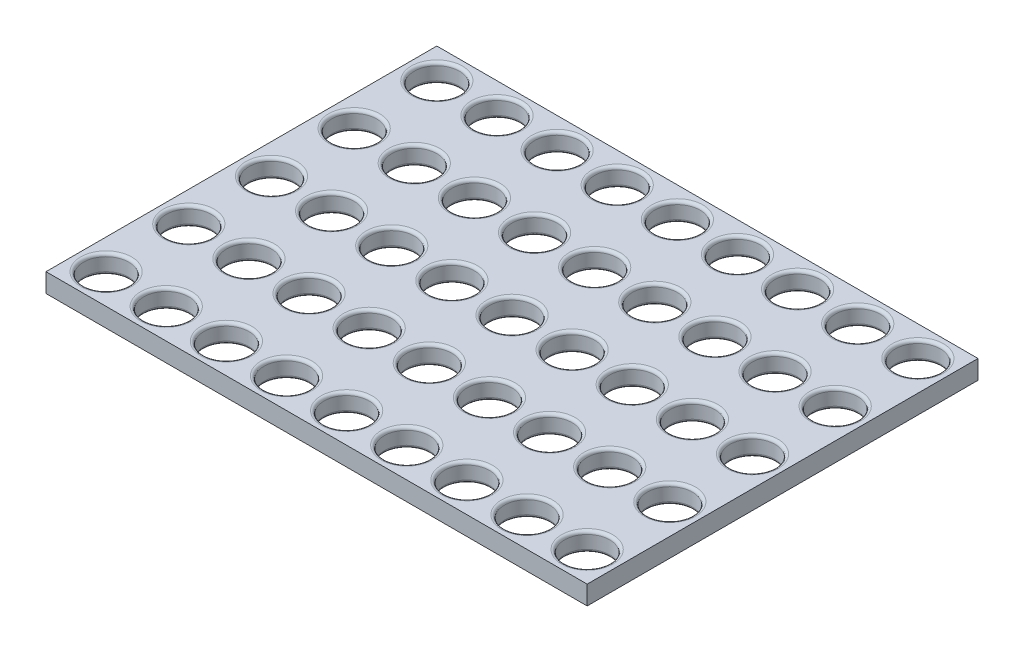
from build123d import *

# Parameters (mm, degrees)
SKETCH1_W           = 45.72
SKETCH1_H           = 33.02
BOSS_EXTRUDE1_DEPTH = 1.6
SKETCH2_R           = 1.905
CUT_EXTRUDE2_DEPTH  = 1.6
FILLET3_R           = 0.254


with BuildPart() as part:
    # Sketch1 → Boss-Extrude1 (new body)
    with BuildSketch(Plane(origin=(0, 0, 0), x_dir=(1, 0, 0), z_dir=(0, 1, 0))):
        with Locations((4.460487805, -3.546707317)):
            Rectangle(SKETCH1_W, SKETCH1_H)
    extrude(amount=BOSS_EXTRUDE1_DEPTH)

    # Sketch2 → Cut-Extrude2 (cut)
    with BuildSketch(Plane(origin=(0, 1.6, 0), x_dir=(1, 0, 0), z_dir=(0, 1, 0))):
        with Locations(Location((-15.859512195, 10.423292683, 0), (0, 0, 270))):
            Circle(SKETCH2_R)
        with Locations(Location((-10.779512195, 10.423292683, 0), (0, 0, 270))):
            Circle(SKETCH2_R)
        with Locations(Location((-5.699512195, 10.423292683, 0), (0, 0, 270))):
            Circle(SKETCH2_R)
        with Locations(Location((-0.619512195, 10.423292683, 0), (0, 0, 270))):
            Circle(SKETCH2_R)
        with Locations(Location((4.460487805, 10.423292683, 0), (0, 0, 270))):
            Circle(SKETCH2_R)
        with Locations(Location((9.540487805, 10.423292683, 0), (0, 0, 270))):
            Circle(SKETCH2_R)
        with Locations(Location((14.620487805, 10.423292683, 0), (0, 0, 270))):
            Circle(SKETCH2_R)
        with Locations(Location((19.700487805, 10.423292683, 0), (0, 0, 270))):
            Circle(SKETCH2_R)
        with Locations(Location((24.780487805, 10.423292683, 0), (0, 0, 270))):
            Circle(SKETCH2_R)
        with Locations(Location((-10.779512195, 3.438292683, 0), (0, 0, 270))):
            Circle(SKETCH2_R)
        with Locations(Location((-5.699512195, 3.438292683, 0), (0, 0, 270))):
            Circle(SKETCH2_R)
        with Locations(Location((-0.619512195, 3.438292683, 0), (0, 0, 270))):
            Circle(SKETCH2_R)
        with Locations(Location((4.460487805, 3.438292683, 0), (0, 0, 270))):
            Circle(SKETCH2_R)
        with Locations(Location((9.540487805, 3.438292683, 0), (0, 0, 270))):
            Circle(SKETCH2_R)
        with Locations(Location((14.620487805, 3.438292683, 0), (0, 0, 270))):
            Circle(SKETCH2_R)
        with Locations(Location((19.700487805, 3.438292683, 0), (0, 0, 270))):
            Circle(SKETCH2_R)
        with Locations(Location((24.780487805, 3.438292683, 0), (0, 0, 270))):
            Circle(SKETCH2_R)
        with Locations(Location((-10.779512195, -3.546707317, 0), (0, 0, 270))):
            Circle(SKETCH2_R)
        with Locations(Location((-5.699512195, -3.546707317, 0), (0, 0, 270))):
            Circle(SKETCH2_R)
        with Locations(Location((-0.619512195, -3.546707317, 0), (0, 0, 270))):
            Circle(SKETCH2_R)
        with Locations(Location((4.460487805, -3.546707317, 0), (0, 0, 270))):
            Circle(SKETCH2_R)
        with Locations(Location((9.540487805, -3.546707317, 0), (0, 0, 270))):
            Circle(SKETCH2_R)
        with Locations(Location((14.620487805, -3.546707317, 0), (0, 0, 270))):
            Circle(SKETCH2_R)
        with Locations(Location((19.700487805, -3.546707317, 0), (0, 0, 270))):
            Circle(SKETCH2_R)
        with Locations(Location((24.780487805, -3.546707317, 0), (0, 0, 270))):
            Circle(SKETCH2_R)
        with Locations(Location((-10.779512195, -10.531707317, 0), (0, 0, 270))):
            Circle(SKETCH2_R)
        with Locations(Location((-5.699512195, -10.531707317, 0), (0, 0, 270))):
            Circle(SKETCH2_R)
        with Locations(Location((-0.619512195, -10.531707317, 0), (0, 0, 270))):
            Circle(SKETCH2_R)
        with Locations(Location((4.460487805, -10.531707317, 0), (0, 0, 270))):
            Circle(SKETCH2_R)
        with Locations(Location((9.540487805, -10.531707317, 0), (0, 0, 270))):
            Circle(SKETCH2_R)
        with Locations(Location((14.620487805, -10.531707317, 0), (0, 0, 270))):
            Circle(SKETCH2_R)
        with Locations(Location((19.700487805, -10.531707317, 0), (0, 0, 270))):
            Circle(SKETCH2_R)
        with Locations(Location((24.780487805, -10.531707317, 0), (0, 0, 270))):
            Circle(SKETCH2_R)
        with Locations(Location((-10.779512195, -17.516707317, 0), (0, 0, 270))):
            Circle(SKETCH2_R)
        with Locations(Location((-5.699512195, -17.516707317, 0), (0, 0, 270))):
            Circle(SKETCH2_R)
        with Locations(Location((-0.619512195, -17.516707317, 0), (0, 0, 270))):
            Circle(SKETCH2_R)
        with Locations(Location((4.460487805, -17.516707317, 0), (0, 0, 270))):
            Circle(SKETCH2_R)
        with Locations(Location((9.540487805, -17.516707317, 0), (0, 0, 270))):
            Circle(SKETCH2_R)
        with Locations(Location((14.620487805, -17.516707317, 0), (0, 0, 270))):
            Circle(SKETCH2_R)
        with Locations(Location((19.700487805, -17.516707317, 0), (0, 0, 270))):
            Circle(SKETCH2_R)
        with Locations(Location((24.780487805, -17.516707317, 0), (0, 0, 270))):
            Circle(SKETCH2_R)
        with Locations(Location((-15.859512195, 3.438292683, 0), (0, 0, 270))):
            Circle(SKETCH2_R)
        with Locations(Location((-15.859512195, -3.546707317, 0), (0, 0, 270))):
            Circle(SKETCH2_R)
        with Locations(Location((-15.859512195, -10.531707317, 0), (0, 0, 270))):
            Circle(SKETCH2_R)
        with Locations(Location((-15.859512195, -17.516707317, 0), (0, 0, 270))):
            Circle(SKETCH2_R)
    extrude(amount=-CUT_EXTRUDE2_DEPTH, mode=Mode.SUBTRACT)

    # Fillet3
    fillet3_edges = [part.edges().sort_by_distance(p)[0] for p in [
        (-0.619512195, 0, 1.641707317),
        (-0.619512195, 1.6, 1.641707317),
        (4.460487805, 0, 1.641707317),
        (4.460487805, 1.6, 1.641707317),
        (9.540487805, 0, 1.641707317),
        (9.540487805, 1.6, 1.641707317),
        (14.620487805, 0, 1.641707317),
        (14.620487805, 1.6, 1.641707317),
        (19.700487805, 0, 1.641707317),
        (19.700487805, 1.6, 1.641707317),
        (24.780487805, 0, 1.641707317),
        (24.780487805, 1.6, 1.641707317),
        (-10.779512195, 0, 8.626707317),
        (-10.779512195, 1.6, 8.626707317),
        (-5.699512195, 0, 8.626707317),
        (-5.699512195, 1.6, 8.626707317),
        (-0.619512195, 0, 8.626707317),
        (-0.619512195, 1.6, 8.626707317),
        (4.460487805, 0, 8.626707317),
        (4.460487805, 1.6, 8.626707317),
        (9.540487805, 0, 8.626707317),
        (9.540487805, 1.6, 8.626707317),
        (14.620487805, 0, 8.626707317),
        (14.620487805, 1.6, 8.626707317),
        (19.700487805, 0, 8.626707317),
        (19.700487805, 1.6, 8.626707317),
        (24.780487805, 0, 8.626707317),
        (24.780487805, 1.6, 8.626707317),
        (-10.779512195, 0, 15.611707317),
        (-10.779512195, 1.6, 15.611707317),
        (-5.699512195, 0, 15.611707317),
        (-5.699512195, 1.6, 15.611707317),
        (-0.619512195, 0, 15.611707317),
        (-0.619512195, 1.6, 15.611707317),
        (4.460487805, 0, 15.611707317),
        (4.460487805, 1.6, 15.611707317),
        (9.540487805, 0, 15.611707317),
        (9.540487805, 1.6, 15.611707317),
        (14.620487805, 0, 15.611707317),
        (14.620487805, 1.6, 15.611707317),
        (19.700487805, 0, 15.611707317),
        (19.700487805, 1.6, 15.611707317),
        (24.780487805, 0, 15.611707317),
        (24.780487805, 1.6, 15.611707317),
        (-15.859512195, 0, -5.343292683),
        (-15.859512195, 1.6, -5.343292683),
        (-15.859512195, 0, 1.641707317),
        (-15.859512195, 1.6, 1.641707317),
        (-15.859512195, 0, 8.626707317),
        (-15.859512195, 1.6, 8.626707317),
        (-15.859512195, 0, 15.611707317),
        (-15.859512195, 1.6, 15.611707317),
        (-15.859512195, 0, -12.328292683),
        (-15.859512195, 1.6, -12.328292683),
        (-10.779512195, 0, -12.328292683),
        (-10.779512195, 1.6, -12.328292683),
        (-5.699512195, 0, -12.328292683),
        (-5.699512195, 1.6, -12.328292683),
        (-0.619512195, 0, -12.328292683),
        (-0.619512195, 1.6, -12.328292683),
        (4.460487805, 0, -12.328292683),
        (4.460487805, 1.6, -12.328292683),
        (9.540487805, 0, -12.328292683),
        (9.540487805, 1.6, -12.328292683),
        (14.620487805, 0, -12.328292683),
        (14.620487805, 1.6, -12.328292683),
        (19.700487805, 0, -12.328292683),
        (19.700487805, 1.6, -12.328292683),
        (24.780487805, 0, -12.328292683),
        (24.780487805, 1.6, -12.328292683),
        (-10.779512195, 0, -5.343292683),
        (-10.779512195, 1.6, -5.343292683),
        (-5.699512195, 0, -5.343292683),
        (-5.699512195, 1.6, -5.343292683),
        (-0.619512195, 0, -5.343292683),
        (-0.619512195, 1.6, -5.343292683),
        (4.460487805, 0, -5.343292683),
        (4.460487805, 1.6, -5.343292683),
        (9.540487805, 0, -5.343292683),
        (9.540487805, 1.6, -5.343292683),
        (14.620487805, 0, -5.343292683),
        (14.620487805, 1.6, -5.343292683),
        (19.700487805, 0, -5.343292683),
        (19.700487805, 1.6, -5.343292683),
        (24.780487805, 0, -5.343292683),
        (24.780487805, 1.6, -5.343292683),
        (-10.779512195, 0, 1.641707317),
        (-10.779512195, 1.6, 1.641707317),
        (-5.699512195, 0, 1.641707317),
        (-5.699512195, 1.6, 1.641707317),
    ]]
    fillet(fillet3_edges, radius=FILLET3_R)


solid = part.part
